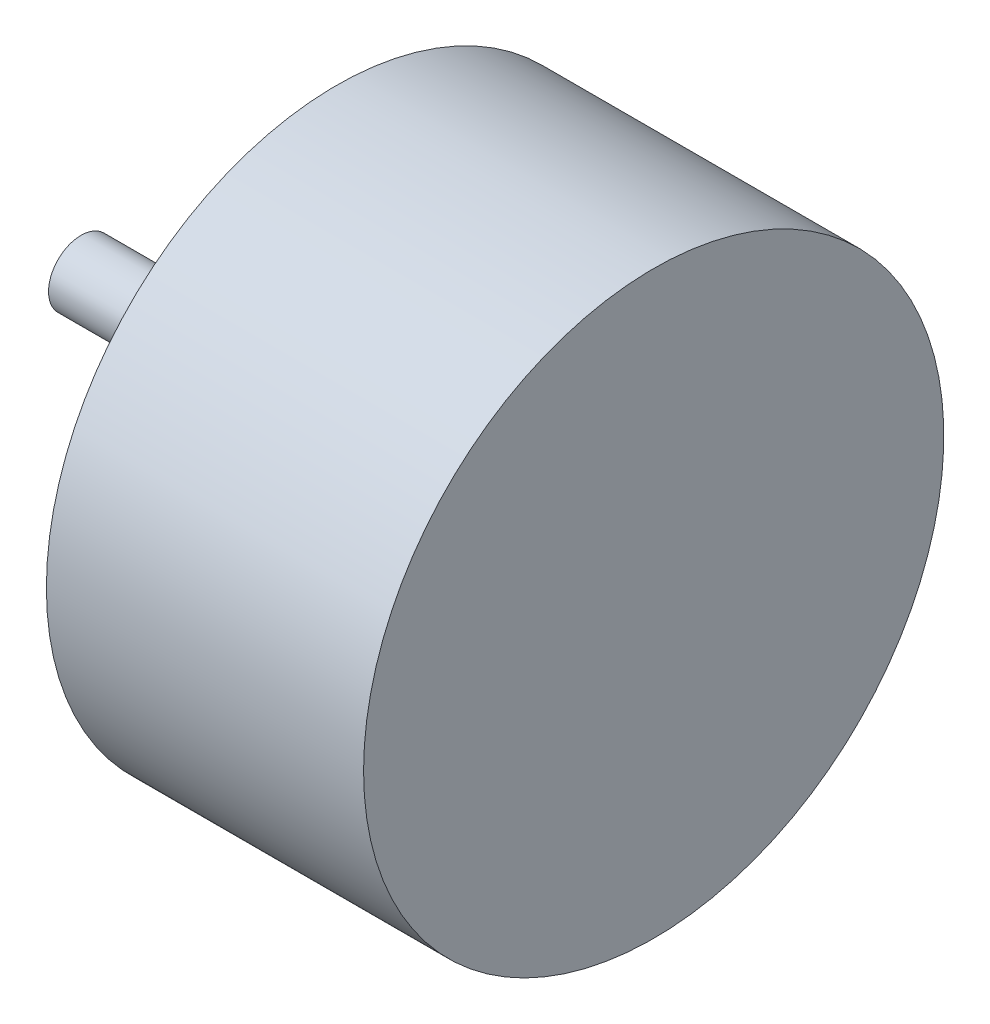
from build123d import *


with BuildPart() as part:
    # Sketch1 → Revolve1 (revolve)
    with BuildSketch(Plane.XY, mode=Mode.PRIVATE) as revolve1_sk:
        Polygon((-5.9, 0), (20.55, 0), (20.55, 13.4), (5.9, 13.4), (5.9, 1.5), (-5.9, 1.5), align=None)
    revolve(revolve1_sk.sketch.rotate(Axis((-5.9, 0, 0), (1, 0, 0)), 90), axis=Axis((-5.9, 0, 0), (1, 0, 0)))


solid = part.part
